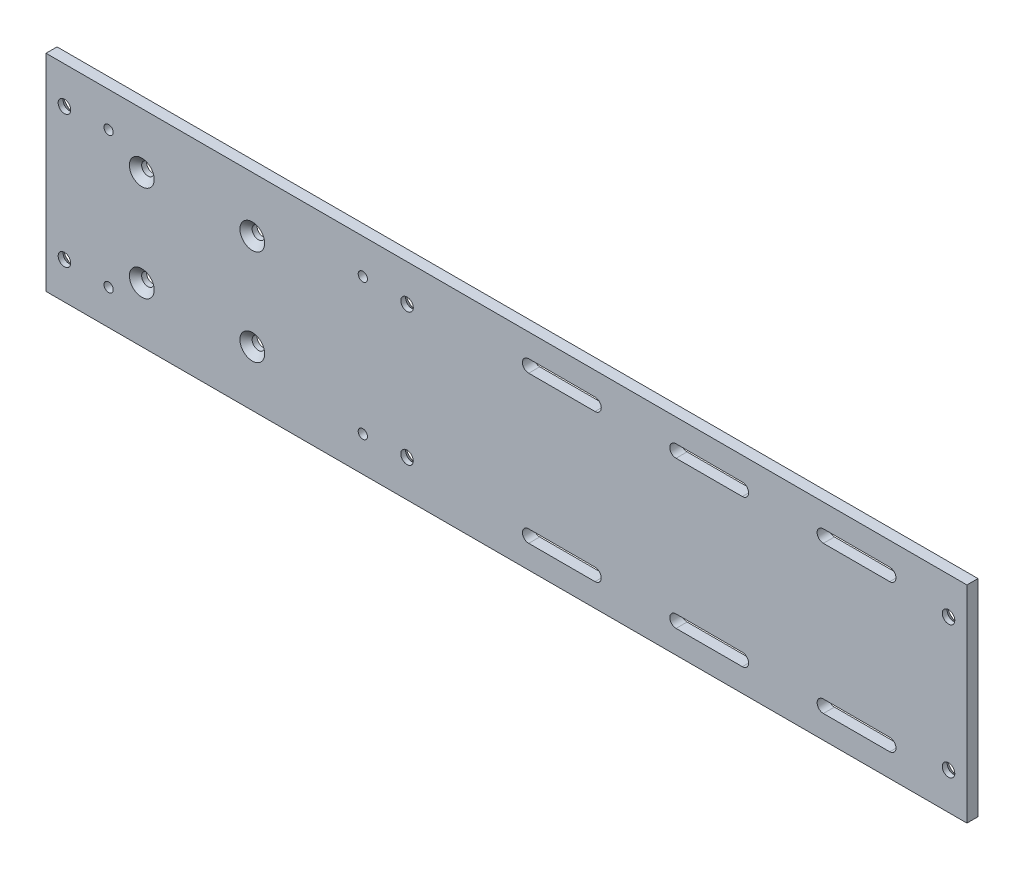
from build123d import *

# Parameters (mm, degrees)
SKETCH_1_W                 = 250
SKETCH_1_H                 = 56
EXTRUDE_1_DEPTH            = 3
HOLE_WIZARD_M32_AT_2_COUNT = 2
HOLE_WIZARD_M32_AT_2_PITCH = 26
HOLE_WIZARD_M32_AT_3_COUNT = 2
HOLE_WIZARD_M32_AT_3_PITCH = 39.698866483
HOLE_WIZARD_M32_AT_4_COUNT = 2
HOLE_WIZARD_M32_AT_4_PITCH = 30
HOLE_WIZARD_M31_AT_2_COUNT = 2
HOLE_WIZARD_M31_AT_2_PITCH = 36
HOLE_WIZARD_M31_AT_3_COUNT = 2
HOLE_WIZARD_M31_AT_3_PITCH = 240
HOLE_WIZARD_M31_AT_4_COUNT = 2
HOLE_WIZARD_M31_AT_4_PITCH = 242.684980994
HOLE_WIZARD_M31_AT_5_COUNT = 2
HOLE_WIZARD_M31_AT_5_PITCH = 93
HOLE_WIZARD_M31_AT_6_COUNT = 2
HOLE_WIZARD_M31_AT_6_PITCH = 99.724620832
CUT_EXTRUDE_3_DEPTH        = 129.132743668
M3X0_51_D                  = 2.5


with BuildPart() as part:
    # Эскиз1 → Бобышка-Вытянуть1 (new body)
    with BuildSketch(Plane.XY):
        Rectangle(SKETCH_1_W, SKETCH_1_H)
    extrude(amount=EXTRUDE_1_DEPTH)

    # Эскиз8 → Зенковка для  винта с потайной головкой с внутренним шестигранником M32 (revolve, cut)
    with BuildSketch(Plane(origin=(-99, 13, 3), x_dir=(0, -1, 0), z_dir=(1, 0, 0))):
        Polygon((0, 0), (0, 3), (1.7, 3), (1.7, 1.66), (3.36, 0), align=None)
    hole_wizard_m32 = revolve(axis=Axis((-99, 13, 9.35), (0, 0, -1)), mode=Mode.SUBTRACT)

    # Зенковка для  винта с потайной головкой с внутренним шестигранником M32 at 2: Зенковка для  винта с потайной головкой с внутренним шестигранником M32 ×2
    with Locations(*[(0, -i * HOLE_WIZARD_M32_AT_2_PITCH, 0) for i in range(1, HOLE_WIZARD_M32_AT_2_COUNT)]):
        add(hole_wizard_m32, mode=Mode.SUBTRACT)

    # Зенковка для  винта с потайной головкой с внутренним шестигранником M32 at 3: Зенковка для  винта с потайной головкой с внутренним шестигранником M32 ×2
    with Locations(*[Vector(0.7556890827898176, -0.6549305384178419, 0) * (i * HOLE_WIZARD_M32_AT_3_PITCH) for i in range(1, HOLE_WIZARD_M32_AT_3_COUNT)]):
        add(hole_wizard_m32, mode=Mode.SUBTRACT)

    # Зенковка для  винта с потайной головкой с внутренним шестигранником M32 at 4: Зенковка для  винта с потайной головкой с внутренним шестигранником M32 ×2
    with Locations(*[(i * HOLE_WIZARD_M32_AT_4_PITCH, 0, 0) for i in range(1, HOLE_WIZARD_M32_AT_4_COUNT)]):
        add(hole_wizard_m32, mode=Mode.SUBTRACT)

    # Эскиз5 → Зенковка для  винта с потайной головкой с внутренним шестигранником M31 (revolve, cut)
    with BuildSketch(Plane(origin=(-120, 18, 0), x_dir=(0, 1, 0), z_dir=(1, 0, 0))):
        Polygon((0, 0), (0, 3), (1.7, 3), (1.7, 1.66), (3.36, 0), align=None)
    hole_wizard_m31 = revolve(axis=Axis((-120, 18, -6.35), (0, 0, 1)), mode=Mode.SUBTRACT)

    # Зенковка для  винта с потайной головкой с внутренним шестигранником M31 at 2: Зенковка для  винта с потайной головкой с внутренним шестигранником M31 ×2
    with Locations(*[(0, -i * HOLE_WIZARD_M31_AT_2_PITCH, 0) for i in range(1, HOLE_WIZARD_M31_AT_2_COUNT)]):
        add(hole_wizard_m31, mode=Mode.SUBTRACT)

    # Зенковка для  винта с потайной головкой с внутренним шестигранником M31 at 3: Зенковка для  винта с потайной головкой с внутренним шестигранником M31 ×2
    with Locations(*[(i * HOLE_WIZARD_M31_AT_3_PITCH, 0, 0) for i in range(1, HOLE_WIZARD_M31_AT_3_COUNT)]):
        add(hole_wizard_m31, mode=Mode.SUBTRACT)

    # Зенковка для  винта с потайной головкой с внутренним шестигранником M31 at 4: Зенковка для  винта с потайной головкой с внутренним шестигранником M31 ×2
    with Locations(*[Vector(0.9889363528682976, -0.14834045293024464, 0) * (i * HOLE_WIZARD_M31_AT_4_PITCH) for i in range(1, HOLE_WIZARD_M31_AT_4_COUNT)]):
        add(hole_wizard_m31, mode=Mode.SUBTRACT)

    # Зенковка для  винта с потайной головкой с внутренним шестигранником M31 at 5: Зенковка для  винта с потайной головкой с внутренним шестигранником M31 ×2
    with Locations(*[(i * HOLE_WIZARD_M31_AT_5_PITCH, 0, 0) for i in range(1, HOLE_WIZARD_M31_AT_5_COUNT)]):
        add(hole_wizard_m31, mode=Mode.SUBTRACT)

    # Зенковка для  винта с потайной головкой с внутренним шестигранником M31 at 6: Зенковка для  винта с потайной головкой с внутренним шестигранником M31 ×2
    with Locations(*[Vector(0.9325680982740896, -0.36099410255771214, 0) * (i * HOLE_WIZARD_M31_AT_6_PITCH) for i in range(1, HOLE_WIZARD_M31_AT_6_COUNT)]):
        add(hole_wizard_m31, mode=Mode.SUBTRACT)

    # Эскиз7 → Вырез-Вытянуть3 (cut, through all)
    with BuildSketch(Plane.XY.offset(3)):
        with BuildLine():
            Line((6.030531049, 21.7), (24.030531049, 21.7))
            ThreePointArc((24.030531049, 21.7), (25.730531049, 20), (24.030531049, 18.3))
            Line((24.030531049, 18.3), (6.030531049, 18.3))
            ThreePointArc((6.030531049, 18.3), (4.330531049, 20), (6.030531049, 21.7))
        make_face()
        with BuildLine():
            Line((46.030531049, 21.7), (64.030531049, 21.7))
            ThreePointArc((64.030531049, 21.7), (65.730531049, 20), (64.030531049, 18.3))
            Line((64.030531049, 18.3), (46.030531049, 18.3))
            ThreePointArc((46.030531049, 18.3), (44.330531049, 20), (46.030531049, 21.7))
        make_face()
        with BuildLine():
            Line((86.030531049, 21.7), (104.030531049, 21.7))
            ThreePointArc((104.030531049, 21.7), (105.730531049, 20), (104.030531049, 18.3))
            Line((104.030531049, 18.3), (86.030531049, 18.3))
            ThreePointArc((86.030531049, 18.3), (84.330531049, 20), (86.030531049, 21.7))
        make_face()
        with BuildLine():
            Line((6.030531049, -18.3), (24.030531049, -18.3))
            ThreePointArc((24.030531049, -18.3), (25.730531049, -20), (24.030531049, -21.7))
            Line((24.030531049, -21.7), (6.030531049, -21.7))
            ThreePointArc((6.030531049, -21.7), (4.330531049, -20), (6.030531049, -18.3))
        make_face()
        with BuildLine():
            Line((46.030531049, -18.3), (64.030531049, -18.3))
            ThreePointArc((64.030531049, -18.3), (65.730531049, -20), (64.030531049, -21.7))
            Line((64.030531049, -21.7), (46.030531049, -21.7))
            ThreePointArc((46.030531049, -21.7), (44.330531049, -20), (46.030531049, -18.3))
        make_face()
        with BuildLine():
            Line((86.030531049, -18.3), (104.030531049, -18.3))
            ThreePointArc((104.030531049, -18.3), (105.730531049, -20), (104.030531049, -21.7))
            Line((104.030531049, -21.7), (86.030531049, -21.7))
            ThreePointArc((86.030531049, -21.7), (84.330531049, -20), (86.030531049, -18.3))
        make_face()
    extrude(amount=-CUT_EXTRUDE_3_DEPTH, mode=Mode.SUBTRACT)

    # Отверстие обработанное метчиком M3x0.51 (through all)
    with Locations(Plane.XY.offset(3)):
        with Locations((-108, 18.5), (-108, -18.5), (-39, -18.5), (-39, 18.5)):
            Hole(M3X0_51_D / 2)


solid = part.part
